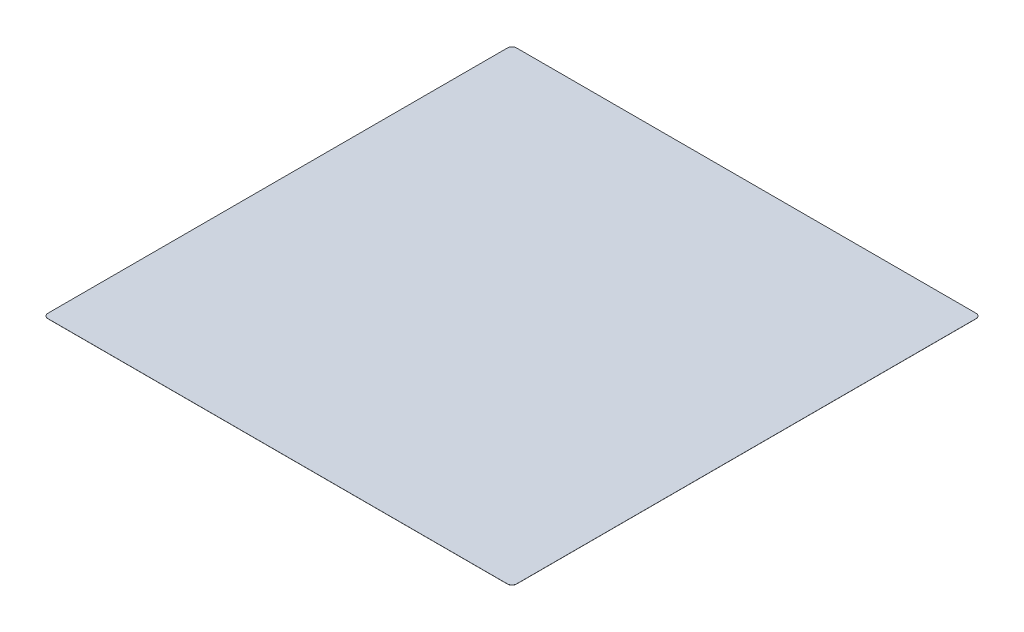
from build123d import *

# Parameters (mm, degrees)
SKETCH1_W           = 100
SKETCH1_H           = 100
BOSS_EXTRUDE1_DEPTH = 0.0127
FILLET1_R           = 1


with BuildPart() as part:
    # Sketch1 → Boss-Extrude1 (new, symmetric)
    with BuildSketch(Plane(origin=(0, 0, 0), x_dir=(1, 0, 0), z_dir=(0, 1, 0))):
        Rectangle(SKETCH1_W, SKETCH1_H)
    extrude(amount=BOSS_EXTRUDE1_DEPTH, both=True)

    # Fillet1
    fillet1_edges = [part.edges().sort_by_distance(p)[0] for p in [
        (50, 0, 50),
        (-50, 0, 50),
        (-50, 0, -50),
        (50, 0, -50),
    ]]
    fillet(fillet1_edges, radius=FILLET1_R)


solid = part.part
